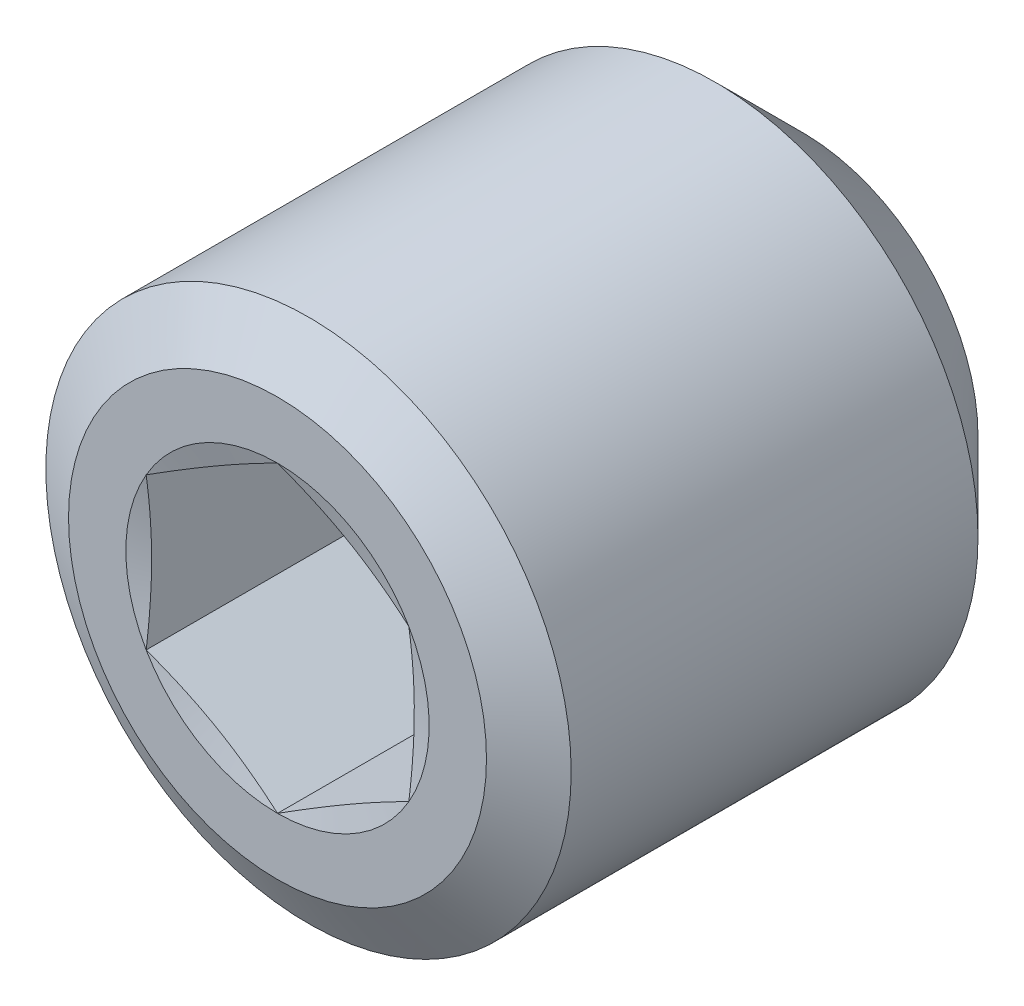
from build123d import *

# Parameters (mm, degrees)
CUT_EXTRUDE1_DEPTH = 1.2


with BuildPart() as part:
    # Sketch1 → Revolve1 (revolve)
    with BuildSketch(Plane(origin=(0, 0, 0), x_dir=(0, 0, -1), z_dir=(1, 0, 0)), mode=Mode.PRIVATE) as revolve1_sk:
        Polygon((0.177073328, 1.5), (2.5, 1.5), (3, 1), (3, 0), (1.633012702, 0), (1.2, 0.75), (0, 0.75), (0, 1.1933), align=None)
    revolve(revolve1_sk.sketch.rotate(Axis((0, 0, 0), (0, 0, -1)), 90), axis=Axis((0, 0, 0), (0, 0, -1)))

    # Sketch2 → Cut-Extrude1 (cut)
    with BuildSketch(Plane.XY):
        Polygon((0, 0.866025404), (-0.75, 0.433012702), (-0.75, -0.433012702), (0, -0.866025404), (0.75, -0.433012702), (0.75, 0.433012702), align=None)
    extrude(amount=-CUT_EXTRUDE1_DEPTH, mode=Mode.SUBTRACT)

    # Sketch3 → Cut-Revolve2 (revolve, cut)
    with BuildSketch(Plane(origin=(0, 0, 0), x_dir=(0, 0, -1), z_dir=(1, 0, 0))):
        Polygon((0, 0.75), (0, 0.866025404), (0.031088913, 0.75), align=None)
    revolve(axis=Axis((0, 0, 0), (0, 0, -1)), mode=Mode.SUBTRACT)


solid = part.part
